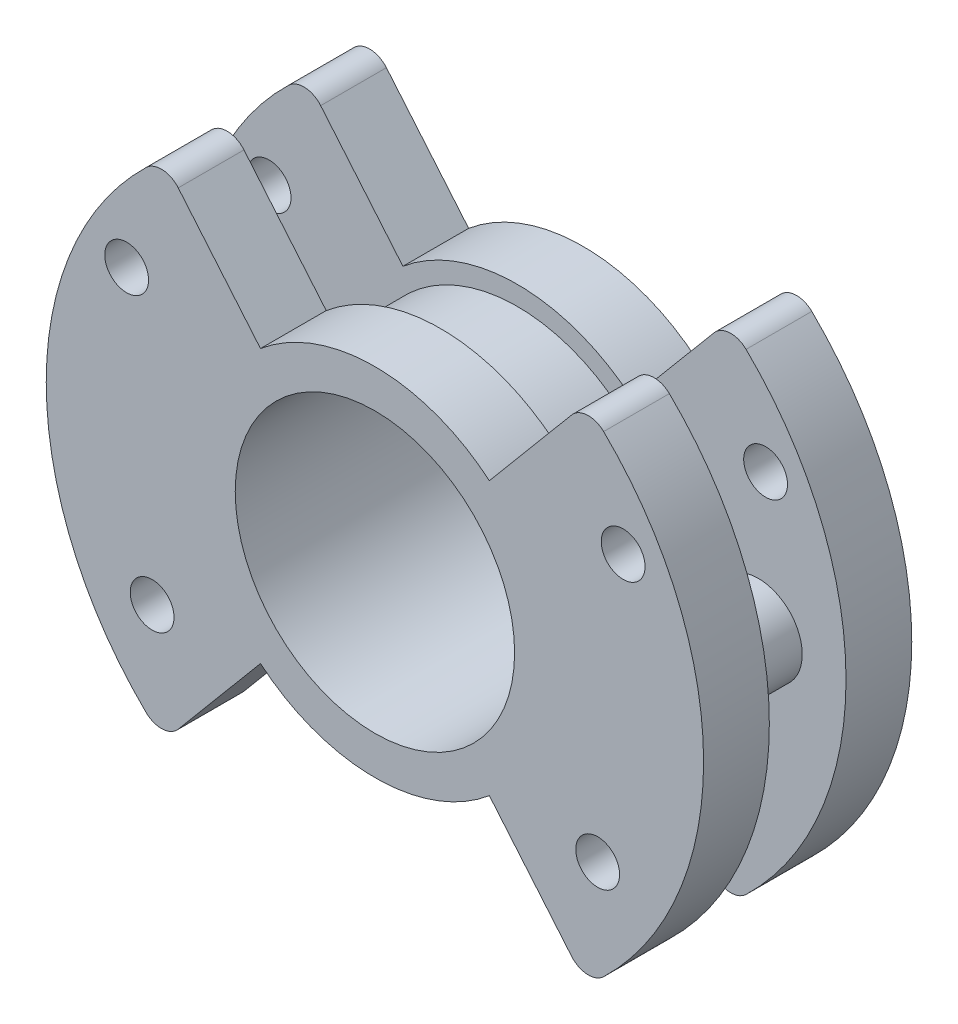
from build123d import *

# Parameters (mm, degrees)
SKETCH1_R               = 30
BOSS_EXTRUDE1_DEPTH     = 6
SKETCH2_R               = 14.5
BOSS_EXTRUDE2_DEPTH     = 13
CUT_EXTRUDE1_DEPTH      = 47.486557197
CUT_EXTRUDE1_DEPTH_BACK = 47.486557197
SKETCH3_R               = 12.75
BOSS_EXTRUDE4_START     = 13
SKETCH5_R               = 30
SKETCH5_R_2             = 12.75
BOSS_EXTRUDE4_DEPTH     = 6
CUT_EXTRUDE2_DEPTH      = 45.373415465
CUT_EXTRUDE2_DEPTH_BACK = 45.373415465
SKETCH6_R               = 2
CUT_EXTRUDE3_DEPTH      = 47.486557197
CUT_EXTRUDE3_DEPTH_BACK = 47.486557197
FILLET1_R               = 2
FILLET2_R               = 2
FILLET3_R               = 2
FILLET4_R               = 2
SKETCH8_R               = 4
BOSS_EXTRUDE5_DEPTH     = 13
FILLET5_R               = 2
FILLET6_R               = 2
FILLET7_R               = 2
FILLET8_R               = 2


with BuildPart() as part:
    # Sketch1 → Boss-Extrude1 (new body)
    with BuildSketch(Plane.XY):
        Circle(SKETCH1_R)
    extrude(amount=-BOSS_EXTRUDE1_DEPTH)

    # Sketch2 → Boss-Extrude2 (add)
    with BuildSketch(Plane.XY):
        with Locations(Location((0, 0, 0), (0, 0, 180))):
            Circle(SKETCH2_R)
    extrude(amount=BOSS_EXTRUDE2_DEPTH)

    # Sketch3 → Cut-Extrude1 (cut, two sides: drawn at the far end of the back side and taken through both)
    with BuildSketch(Plane.XY.offset(13).offset(-CUT_EXTRUDE1_DEPTH_BACK)):
        Circle(SKETCH3_R)
    extrude(amount=CUT_EXTRUDE1_DEPTH + CUT_EXTRUDE1_DEPTH_BACK, mode=Mode.SUBTRACT)

    # Sketch5 → Boss-Extrude4 (add)
    with BuildSketch(Plane.XY.offset(BOSS_EXTRUDE4_START)):
        Circle(SKETCH5_R)
        Circle(SKETCH5_R_2, mode=Mode.SUBTRACT)
    extrude(amount=-BOSS_EXTRUDE4_DEPTH)

    # Sketch6 → Cut-Extrude2 (cut, two sides: drawn at the far end of the back side and taken through both)
    with BuildSketch(Plane.XY.offset(-CUT_EXTRUDE2_DEPTH_BACK)):
        with Locations((-20.333162568, -12.75)):
            Circle(SKETCH6_R)
        with Locations((-22.659159296, 12.75)):
            Circle(SKETCH6_R)
        with Locations((20.333162568, -12.75)):
            Circle(SKETCH6_R)
        with Locations((22.659159296, 12.75)):
            Circle(SKETCH6_R)
    extrude(amount=CUT_EXTRUDE2_DEPTH + CUT_EXTRUDE2_DEPTH_BACK, mode=Mode.SUBTRACT)

    # Sketch7 → Cut-Extrude3 (cut, two sides: drawn at the far end of the back side and taken through both)
    with BuildSketch(Plane.XY.offset(13).offset(-CUT_EXTRUDE3_DEPTH_BACK)):
        with BuildLine():
            Line((10.445298657, -12.448222201), (19.283628291, -22.981333294))
            ThreePointArc((19.283628291, -22.981333294), (0, -30), (-19.283628291, -22.981333294))
            Line((-19.283628291, -22.981333294), (-10.445298657, -12.448222201))
            ThreePointArc((-10.445298657, -12.448222201), (0, -16.25), (10.445298657, -12.448222201))
        make_face()
        with BuildLine():
            Line((-10.445298657, 12.448222201), (-19.283628291, 22.981333294))
            ThreePointArc((-19.283628291, 22.981333294), (0, 30), (19.283628291, 22.981333294))
            Line((19.283628291, 22.981333294), (10.445298657, 12.448222201))
            ThreePointArc((10.445298657, 12.448222201), (0, 16.25), (-10.445298657, 12.448222201))
        make_face()
    extrude(amount=CUT_EXTRUDE3_DEPTH + CUT_EXTRUDE3_DEPTH_BACK, mode=Mode.SUBTRACT)

    # Fillet1
    fillet1_edges = [part.edges().sort_by_distance(p)[0] for p in [
        (-19.283628291, -22.981333294, 10),
    ]]
    fillet(fillet1_edges, radius=FILLET1_R)

    # Fillet2
    fillet2_edges = [part.edges().sort_by_distance(p)[0] for p in [
        (-19.283628291, 22.981333294, 10),
    ]]
    fillet(fillet2_edges, radius=FILLET2_R)

    # Fillet3
    fillet3_edges = [part.edges().sort_by_distance(p)[0] for p in [
        (19.283628291, 22.981333294, 10),
    ]]
    fillet(fillet3_edges, radius=FILLET3_R)

    # Fillet4
    fillet4_edges = [part.edges().sort_by_distance(p)[0] for p in [
        (19.283628291, -22.981333294, 10),
    ]]
    fillet(fillet4_edges, radius=FILLET4_R)

    # Sketch8 → Boss-Extrude5 (add)
    with BuildSketch(Plane.XY.offset(13)):
        with Locations((-22, 0)):
            Circle(SKETCH8_R)
        with Locations((22, 0)):
            Circle(SKETCH8_R)
    extrude(amount=-BOSS_EXTRUDE5_DEPTH)

    # Fillet5
    fillet5_edges = [part.edges().sort_by_distance(p)[0] for p in [
        (-19.283628291, 22.981333294, -3),
    ]]
    fillet(fillet5_edges, radius=FILLET5_R)

    # Fillet6
    fillet6_edges = [part.edges().sort_by_distance(p)[0] for p in [
        (-19.283628291, -22.981333294, -3),
    ]]
    fillet(fillet6_edges, radius=FILLET6_R)

    # Fillet7
    fillet7_edges = [part.edges().sort_by_distance(p)[0] for p in [
        (19.283628291, -22.981333294, -3),
    ]]
    fillet(fillet7_edges, radius=FILLET7_R)

    # Fillet8
    fillet8_edges = [part.edges().sort_by_distance(p)[0] for p in [
        (19.283628291, 22.981333294, -3),
    ]]
    fillet(fillet8_edges, radius=FILLET8_R)


solid = part.part
